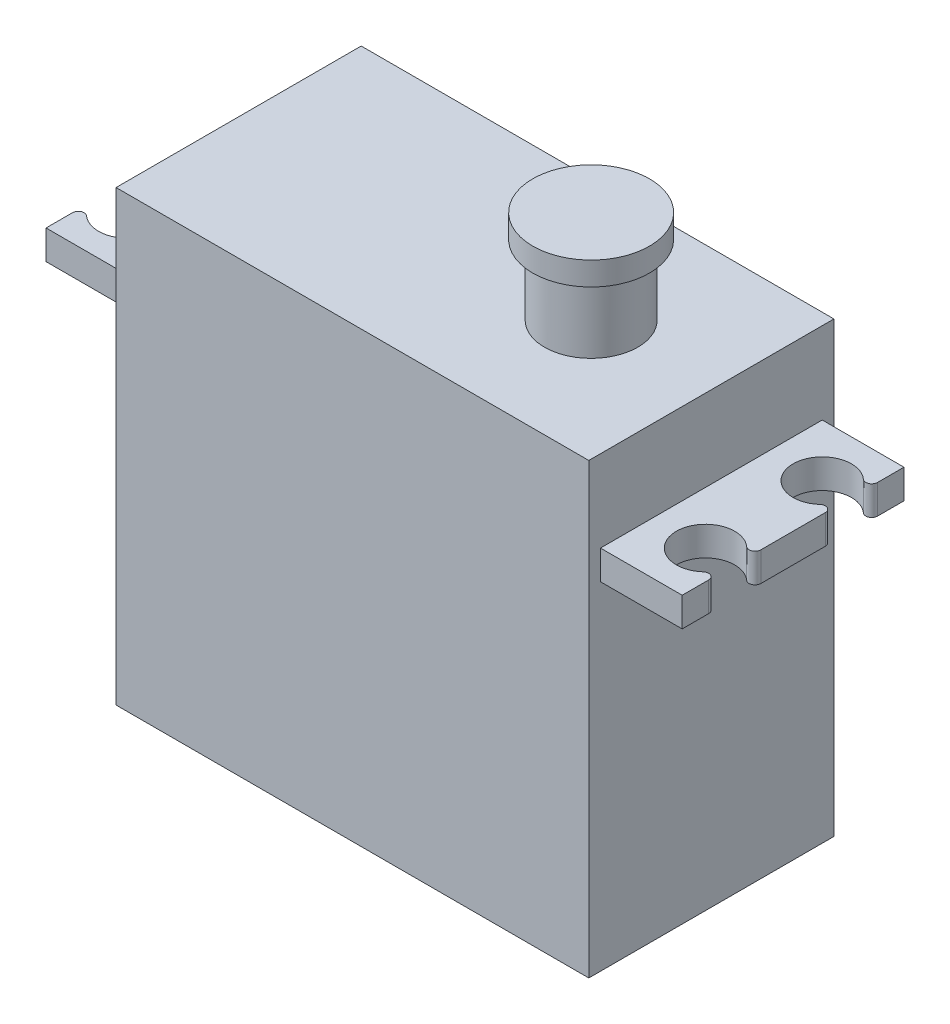
from build123d import *

# Parameters (mm, degrees)
SKETCH1_W           = 40.5
SKETCH1_H           = 21
BOSS_EXTRUDE1_DEPTH = 38.4
SKETCH2_R           = 4
BOSS_EXTRUDE2_DEPTH = 6
SKETCH3_R           = 5
SKETCH3_R_2         = 4
BOSS_EXTRUDE3_DEPTH = 2
BOSS_EXTRUDE5_START = 15.5
BOSS_EXTRUDE5_DEPTH = 2.5


with BuildPart() as part:
    # Sketch1 → Boss-Extrude1 (new body)
    with BuildSketch(Plane(origin=(0, 0, 0), x_dir=(1, 0, 0), z_dir=(0, 1, 0))):
        Rectangle(SKETCH1_W, SKETCH1_H)
    extrude(amount=BOSS_EXTRUDE1_DEPTH)

    # Sketch2 → Boss-Extrude2 (add)
    with BuildSketch(Plane(origin=(0, 38.4, 0), x_dir=(1, 0, 0), z_dir=(0, 1, 0))):
        with Locations(Location((9.95, 0, 0), (0, 0, 90))):
            Circle(SKETCH2_R)
    extrude(amount=BOSS_EXTRUDE2_DEPTH)

    # Sketch6 → Boss-Extrude5 (add)
    with BuildSketch(Plane.XZ.offset(-44.4).offset(BOSS_EXTRUDE5_START)):
        with BuildLine():
            Line((-27.25, -7.236067977), (-27.25, -9.5))
            Line((-27.25, -9.5), (27.25, -9.5))
            Line((27.25, -9.5), (27.25, -7.236067977))
            ThreePointArc((27.25, -7.236067977), (26.954124145, -6.779632513), (26.416666667, -6.863389981))
            ThreePointArc((26.416666667, -6.863389981), (22.25, -5), (26.416666667, -3.136610019))
            ThreePointArc((26.416666667, -3.136610019), (26.954124145, -3.220367487), (27.25, -2.763932023))
            Line((27.25, -2.763932023), (27.25, 2.763932023))
            ThreePointArc((27.25, 2.763932023), (26.954124145, 3.220367487), (26.416666667, 3.136610019))
            ThreePointArc((26.416666667, 3.136610019), (22.25, 5), (26.416666667, 6.863389981))
            ThreePointArc((26.416666667, 6.863389981), (26.954124145, 6.779632513), (27.25, 7.236067977))
            Line((27.25, 7.236067977), (27.25, 9.5))
            Line((27.25, 9.5), (-27.25, 9.5))
            Line((-27.25, 9.5), (-27.25, 7.236067977))
            ThreePointArc((-27.25, 7.236067977), (-26.954124145, 6.779632513), (-26.416666667, 6.863389981))
            ThreePointArc((-26.416666667, 6.863389981), (-22.25, 5), (-26.416666667, 3.136610019))
            ThreePointArc((-26.416666667, 3.136610019), (-26.954124145, 3.220367487), (-27.25, 2.763932023))
            Line((-27.25, 2.763932023), (-27.25, -2.763932023))
            ThreePointArc((-27.25, -2.763932023), (-26.954124145, -3.220367487), (-26.416666667, -3.136610019))
            ThreePointArc((-26.416666667, -3.136610019), (-22.25, -5), (-26.416666667, -6.863389981))
            ThreePointArc((-26.416666667, -6.863389981), (-26.954124145, -6.779632513), (-27.25, -7.236067977))
        make_face()
    extrude(amount=-BOSS_EXTRUDE5_DEPTH)


with BuildPart() as body_2:
    # Sketch3 → Boss-Extrude3 (new body)
    # profile 1 of 2: a face of its own
    with BuildSketch(Plane(origin=(0, 44.4, 0), x_dir=(1, 0, 0), z_dir=(0, 1, 0))):
        with Locations(Location((9.95, 0, 0), (0, 0, 270))):
            Circle(SKETCH3_R)
        with Locations(Location((9.95, 0, 0), (0, 0, 90))):
            Circle(SKETCH3_R_2, mode=Mode.SUBTRACT)
    # profile 2 of 2: a face of its own
    with BuildSketch(Plane(origin=(0, 44.4, 0), x_dir=(1, 0, 0), z_dir=(0, 1, 0))):
        with Locations(Location((9.95, 0, 0), (0, 0, 90))):
            Circle(SKETCH3_R_2)
    extrude(amount=BOSS_EXTRUDE3_DEPTH)


solid = Compound([part.part, body_2.part])
